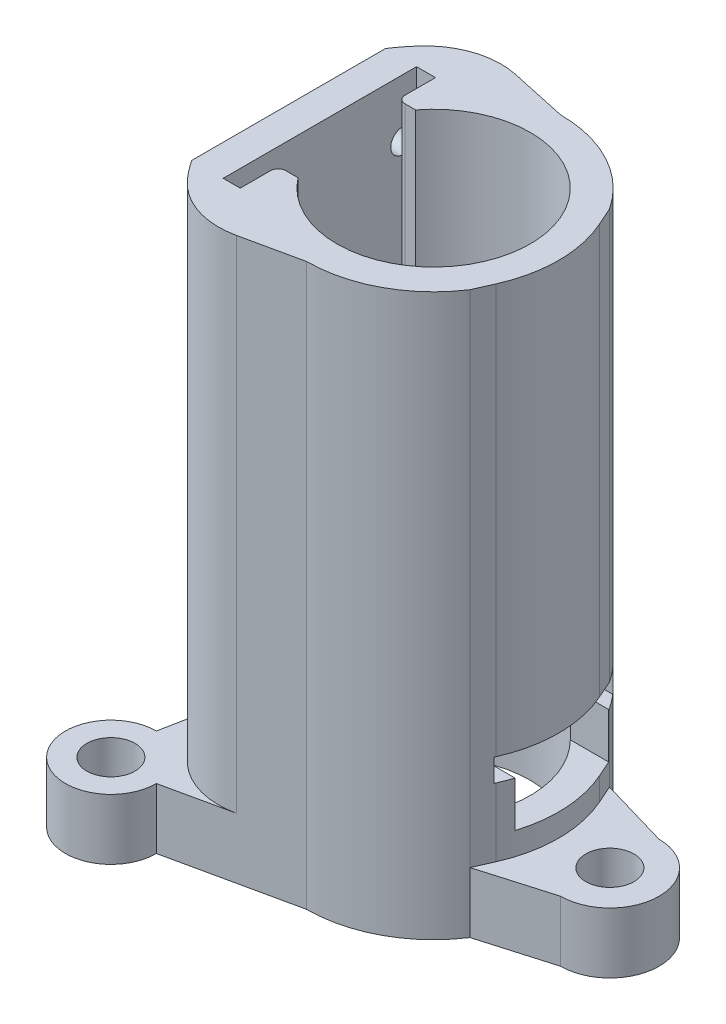
from build123d import *

# Parameters (mm, degrees)
SKETCH1_R           = 12.75
SKETCH1_R_2         = 3.175
BOSS_EXTRUDE2_DEPTH = 8
BOSS_EXTRUDE3_DEPTH = 66
SKETCH4_R           = 1.6
CUT_EXTRUDE1_DEPTH  = 6
CUT_EXTRUDE2_DEPTH  = 62
BOSS_EXTRUDE4_DEPTH = 10
CUT_EXTRUDE3_START  = -66
CUT_EXTRUDE3_DEPTH  = 66


with BuildPart() as part:
    # Sketch1 → Boss-Extrude2 (new body)
    with BuildSketch(Plane(origin=(0, 0, 0), x_dir=(1, 0, 0), z_dir=(0, 1, 0))):
        with BuildLine():
            Line((0, 16.75), (-16.278174593, 20.278174593))
            ThreePointArc((-16.278174593, 20.278174593), (-26.52081528, 24.52081528), (-22.278174593, 14.278174593))
            Line((-22.278174593, 14.278174593), (-19.5, 0))
            Line((-19.5, 0), (-22.278174593, -14.278174593))
            ThreePointArc((-22.278174593, -14.278174593), (-26.52081528, -24.52081528), (-16.278174593, -20.278174593))
            Line((-16.278174593, -20.278174593), (0, -16.75))
            ThreePointArc((0, -16.75), (7.9526392, -14.741710543), (13.998269272, -9.198421462))
            Line((13.998269272, -9.198421462), (23.25, -6.5))
            ThreePointArc((23.25, -6.5), (29.75, 0), (23.25, 6.5))
            Line((23.25, 6.5), (13.998269272, 9.198421462))
            ThreePointArc((13.998269272, 9.198421462), (7.9526392, 14.741710543), (0, 16.75))
        make_face()
        with Locations(Location((0, 0, 0), (0, 0, 270))):
            Circle(SKETCH1_R, mode=Mode.SUBTRACT)
        with Locations(Location((23.25, 0, 0), (0, 0, 270))):
            Circle(SKETCH1_R_2, mode=Mode.SUBTRACT)
        with Locations(Location((-22.278174593, 20.278174593, 0), (0, 0, 270))):
            Circle(SKETCH1_R_2, mode=Mode.SUBTRACT)
        with Locations(Location((-22.278174593, -20.278174593, 0), (0, 0, 90))):
            Circle(SKETCH1_R_2, mode=Mode.SUBTRACT)
    extrude(amount=BOSS_EXTRUDE2_DEPTH)

    # Sketch2 → Boss-Extrude3 (add)
    with BuildSketch(Plane(origin=(0, 8, 0), x_dir=(1, 0, 0), z_dir=(0, 1, 0))):
        with BuildLine():
            Line((-7.607743292, -18.398922392), (0, -16.75))
            ThreePointArc((0, -16.75), (7.9526392, -14.741710543), (13.998269272, -9.198421462))
            Line((13.998269272, -9.198421462), (15.058663133, -6.806802563))
            ThreePointArc((15.058663133, -6.806802563), (16.5, 0), (15.058663133, 6.806802563))
            Line((15.058663133, 6.806802563), (13.998269272, 9.198421462))
            ThreePointArc((13.998269272, 9.198421462), (7.9526392, 14.741710543), (0, 16.75))
            Line((0, 16.75), (-7.607743292, 18.398922392))
            ThreePointArc((-7.607743292, 18.398922392), (-12.83286117, 18.130965758), (-17.207513674, 15.261109827))
            ThreePointArc((-17.207513674, 15.261109827), (-17.954443829, 14.374906845), (-18.65578326, 13.452202458))
            ThreePointArc((-18.65578326, 13.452202458), (-18.894540484, 13.105967779), (-19.118527996, 12.75))
            Line((-19.118527996, 12.75), (-19.118527996, -12.75))
            ThreePointArc((-19.118527996, -12.75), (-18.894540484, -13.105967779), (-18.65578326, -13.452202458))
            ThreePointArc((-18.65578326, -13.452202458), (-17.954443829, -14.374906845), (-17.207513674, -15.261109827))
            ThreePointArc((-17.207513674, -15.261109827), (-12.83286117, -18.130965758), (-7.607743292, -18.398922392))
        make_face()
        with BuildLine():
            Line((-15, 12.75), (-15, -12.75))
            Line((-15, -12.75), (-12.75, -12.75))
            Line((-12.75, -12.75), (-12.75, -8.75))
            ThreePointArc((-12.75, -8.75), (-12.457106781, -8.042893219), (-11.75, -7.75))
            Line((-11.75, -7.75), (-10.124228366, -7.75))
            ThreePointArc((-10.124228366, -7.75), (12.75, 0), (-10.124228366, 7.75))
            Line((-10.124228366, 7.75), (-11.5, 7.75))
            ThreePointArc((-11.5, 7.75), (-12.207106781, 8.042893219), (-12.5, 8.75))
            Line((-12.5, 8.75), (-12.5, 12.75))
            Line((-12.5, 12.75), (-15, 12.75))
        make_face(mode=Mode.SUBTRACT)
    extrude(amount=BOSS_EXTRUDE3_DEPTH)

    # Sketch4 → Cut-Extrude1 (cut)
    with BuildSketch(Plane.ZY.offset(19.118527996)):
        with Locations((10.95, 66.47)):
            Circle(SKETCH4_R)
        with Locations(Location((-10.95, 66.47, 0), (0, 0, 180))):
            Circle(SKETCH4_R)
        with Locations((10.95, 34.72)):
            Circle(SKETCH4_R)
        with Locations(Location((-10.95, 34.72, 0), (0, 0, 180))):
            Circle(SKETCH4_R)
    extrude(amount=-CUT_EXTRUDE1_DEPTH, mode=Mode.SUBTRACT)

    # Sketch5 → Cut-Extrude2 (cut)
    with BuildSketch(Plane(origin=(-15, 0, 0), x_dir=(0, 0, -1), z_dir=(1, 0, 0))):
        Polygon((-5, 17), (-7, 17), (-7, 20), (0, 20), (11, 20), (11, 17), (9, 17), (9, 11), (0, 11), (-5, 11), align=None)
    extrude(amount=CUT_EXTRUDE2_DEPTH, mode=Mode.SUBTRACT)

    # Sketch6 → Boss-Extrude4 (add)
    with BuildSketch(Plane(origin=(-15, 0, 0), x_dir=(0, 0, -1), z_dir=(1, 0, 0))):
        Polygon((11, 20), (11, 17), (9, 17), (9, 11), (6.130608727, 11), (6.130608727, 20), align=None)
    extrude(amount=BOSS_EXTRUDE4_DEPTH)

    # Sketch7 → Cut-Extrude3 (cut)
    with BuildSketch(Plane(origin=(0, 74, 0), x_dir=(1, 0, 0), z_dir=(0, 1, 0)).offset(CUT_EXTRUDE3_START)):
        with BuildLine():
            Line((-15, 12.75), (-15, 4.5))
            Line((-15, 4.5), (-3.997712125, 4.5))
            Line((-3.997712125, 4.5), (-3.997712125, 12.107055702))
            ThreePointArc((-3.997712125, 12.107055702), (-7.389403522, 10.39034242), (-10.124228366, 7.75))
            Line((-10.124228366, 7.75), (-11.5, 7.75))
            ThreePointArc((-11.5, 7.75), (-12.207106781, 8.042893219), (-12.5, 8.75))
            Line((-12.5, 8.75), (-12.5, 12.75))
            Line((-12.5, 12.75), (-15, 12.75))
        make_face()
    extrude(amount=CUT_EXTRUDE3_DEPTH, mode=Mode.SUBTRACT)


solid = part.part
